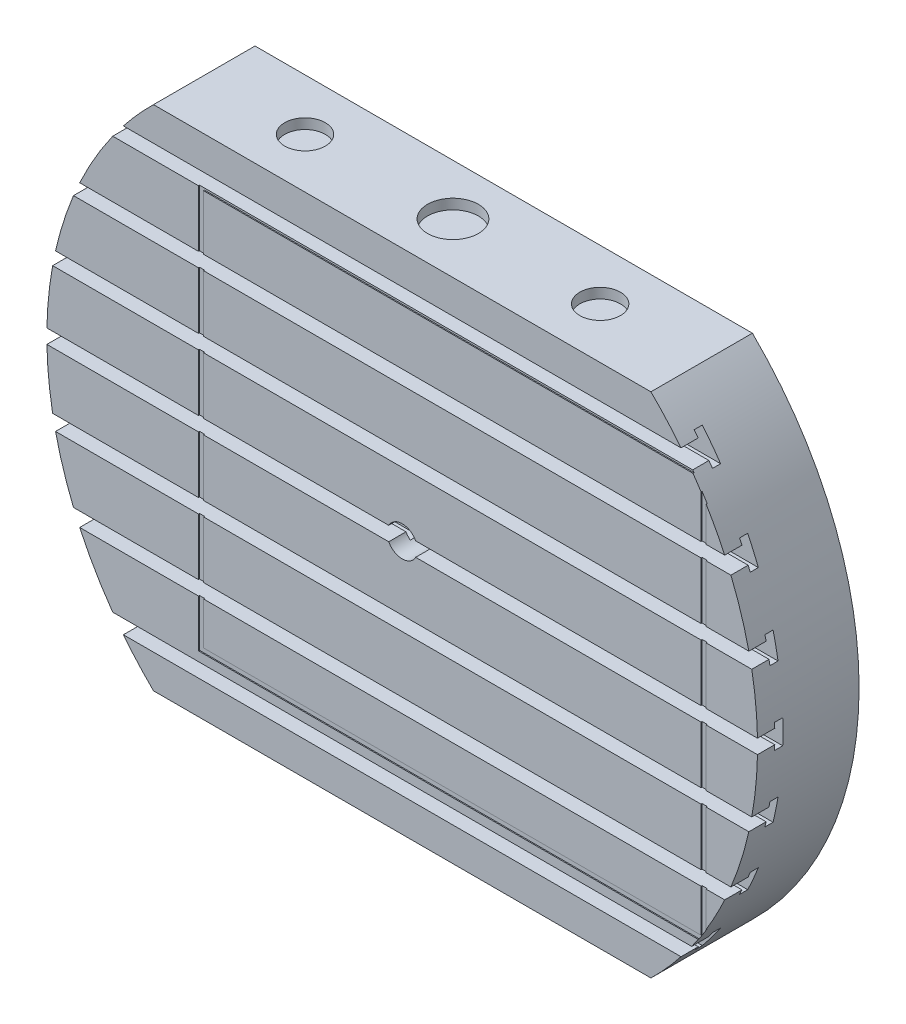
from build123d import *

# Parameters (mm, degrees)
SKETCH1_R           = 350
SKETCH1_R_2         = 15
BOSS_EXTRUDE1_DEPTH = 100
SKETCH2_W           = 100
SKETCH2_H           = 100
CUT_EXTRUDE1_DEPTH  = 500
SKETCH3_W           = 500
SKETCH3_H           = 400
SKETCH3_W_2         = 490
SKETCH3_H_2         = 390
CUT_EXTRUDE2_DEPTH  = 1
SKETCH4_R           = 25
SKETCH4_R_2         = 20
CUT_EXTRUDE3_DEPTH  = 10


with BuildPart() as part:
    # Sketch1 → Boss-Extrude1 (new body)
    with BuildSketch(Plane.XY):
        Circle(SKETCH1_R)
        Circle(SKETCH1_R_2, mode=Mode.SUBTRACT)
    extrude(amount=BOSS_EXTRUDE1_DEPTH)

    # Sketch2 → Cut-Extrude1 (cut, symmetric)
    with BuildSketch(Plane(origin=(0, 0, 0), x_dir=(0, 0, -1), z_dir=(1, 0, 0))):
        Polygon((-100, 7), (-83, 7), (-83, 12), (-75, 12), (-75, -12), (-83, -12), (-83, -7), (-100, -7), align=None)
        Polygon((-100, -77), (-100, -63), (-83, -63), (-83, -58), (-75, -58), (-75, -82), (-83, -82), (-83, -77), align=None)
        Polygon((-100, -147), (-100, -133), (-83, -133), (-83, -128), (-75, -128), (-75, -152), (-83, -152), (-83, -147), align=None)
        Polygon((-100, -217), (-100, -203), (-83, -203), (-83, -198), (-75, -198), (-75, -222), (-83, -222), (-83, -217), align=None)
        with Locations((-50, -300)):
            Rectangle(SKETCH2_W, SKETCH2_H)
        Polygon((-100, 63), (-100, 77), (-83, 77), (-83, 82), (-75, 82), (-75, 58), (-83, 58), (-83, 63), align=None)
        with Locations((-50, 300)):
            Rectangle(SKETCH2_W, SKETCH2_H)
        Polygon((-100, 133), (-100, 147), (-83, 147), (-83, 152), (-75, 152), (-75, 128), (-83, 128), (-83, 133), align=None)
        Polygon((-100, 203), (-100, 217), (-83, 217), (-83, 222), (-75, 222), (-75, 198), (-83, 198), (-83, 203), align=None)
    extrude(amount=CUT_EXTRUDE1_DEPTH, both=True, mode=Mode.SUBTRACT)

    # Sketch3 → Cut-Extrude2 (cut)
    with BuildSketch(Plane.XY.offset(100)):
        with Locations((49.34, 6.2164)):
            Rectangle(SKETCH3_W, SKETCH3_H)
        with Locations((49.34, 6.2164)):
            Rectangle(SKETCH3_W_2, SKETCH3_H_2, mode=Mode.SUBTRACT)
    extrude(amount=-CUT_EXTRUDE2_DEPTH, mode=Mode.SUBTRACT)

    # Sketch4 → Cut-Extrude3 (cut)
    with BuildSketch(Plane.XZ.offset(-250)):
        with Locations(Location((0, 50, 0), (0, 0, 270))):
            Circle(SKETCH4_R)
        with Locations(Location((144.948974278, 50, 0), (0, 0, 270))):
            Circle(SKETCH4_R_2)
        with Locations(Location((-144.948974278, 50.764190285, 0), (0, 0, 270))):
            Circle(SKETCH4_R_2)
    extrude(amount=CUT_EXTRUDE3_DEPTH, mode=Mode.SUBTRACT)


solid = part.part
